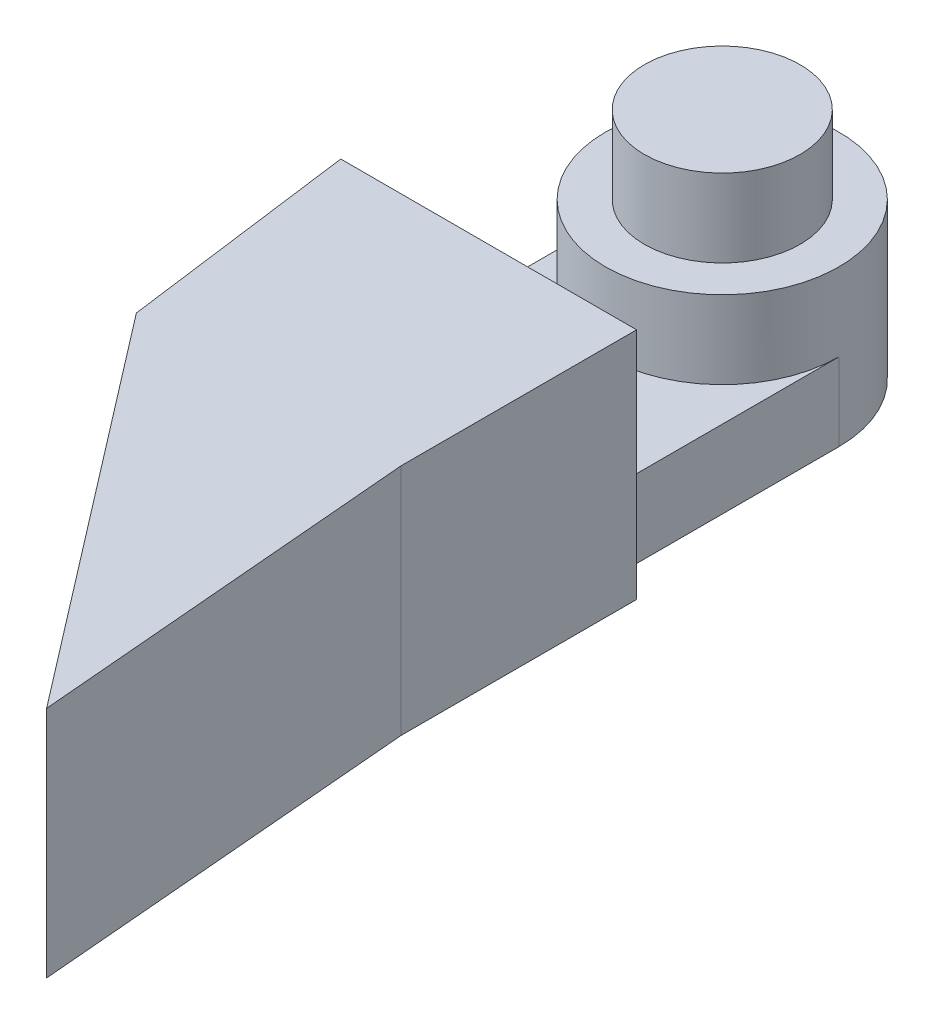
from build123d import *

# Parameters (mm, degrees)
SKETCH1_R           = 7.5
SKETCH1_R_2         = 5
BOSS_EXTRUDE1_DEPTH = 10
BOSS_EXTRUDE2_DEPTH = 15
BOSS_EXTRUDE3_DEPTH = 5
SKETCH1_5_R         = 5
BOSS_EXTRUDE4_DEPTH = 15


with BuildPart() as part:
    # Sketch1 → Boss-Extrude1 (new body)
    with BuildSketch(Plane(origin=(0, 0, 0), x_dir=(1, 0, 0), z_dir=(0, 1, 0))):
        Circle(SKETCH1_R)
        Circle(SKETCH1_R_2, mode=Mode.SUBTRACT)
    extrude(amount=BOSS_EXTRUDE1_DEPTH)



with BuildPart() as body_2:
    # Sketch1<3> → Boss-Extrude2 (new body)
    with BuildSketch(Plane(origin=(0, 0, 0), x_dir=(1, 0, 0), z_dir=(0, 1, 0))):
        Polygon((-7.5, -15), (-9.5, -15), (-7.5, -30.12715853), (11.607364561, -55), (9.5, -30.12715853), (9.5, -15), (7.5, -15), align=None)
    extrude(amount=BOSS_EXTRUDE2_DEPTH)


with BuildPart() as part_1:
    add(part.part)

    add(body_2.part)  # Boss-Extrude3 merges body 2
    # Sketch1<4> → Boss-Extrude3 (add)
    with BuildSketch(Plane(origin=(0, 0, 0), x_dir=(1, 0, 0), z_dir=(0, 1, 0))):
        with BuildLine():
            Line((-7.5, 0), (-7.5, -15))
            Line((-7.5, -15), (7.5, -15))
            Line((7.5, -15), (7.5, 0))
            ThreePointArc((7.5, 0), (0, -7.5), (-7.5, 0))
        make_face()
    extrude(amount=BOSS_EXTRUDE3_DEPTH)

    # Sketch1<5> → Boss-Extrude4 (add)
    with BuildSketch(Plane(origin=(0, 0, 0), x_dir=(1, 0, 0), z_dir=(0, 1, 0))):
        Circle(SKETCH1_5_R)
    extrude(amount=BOSS_EXTRUDE4_DEPTH)


solid = part_1.part
